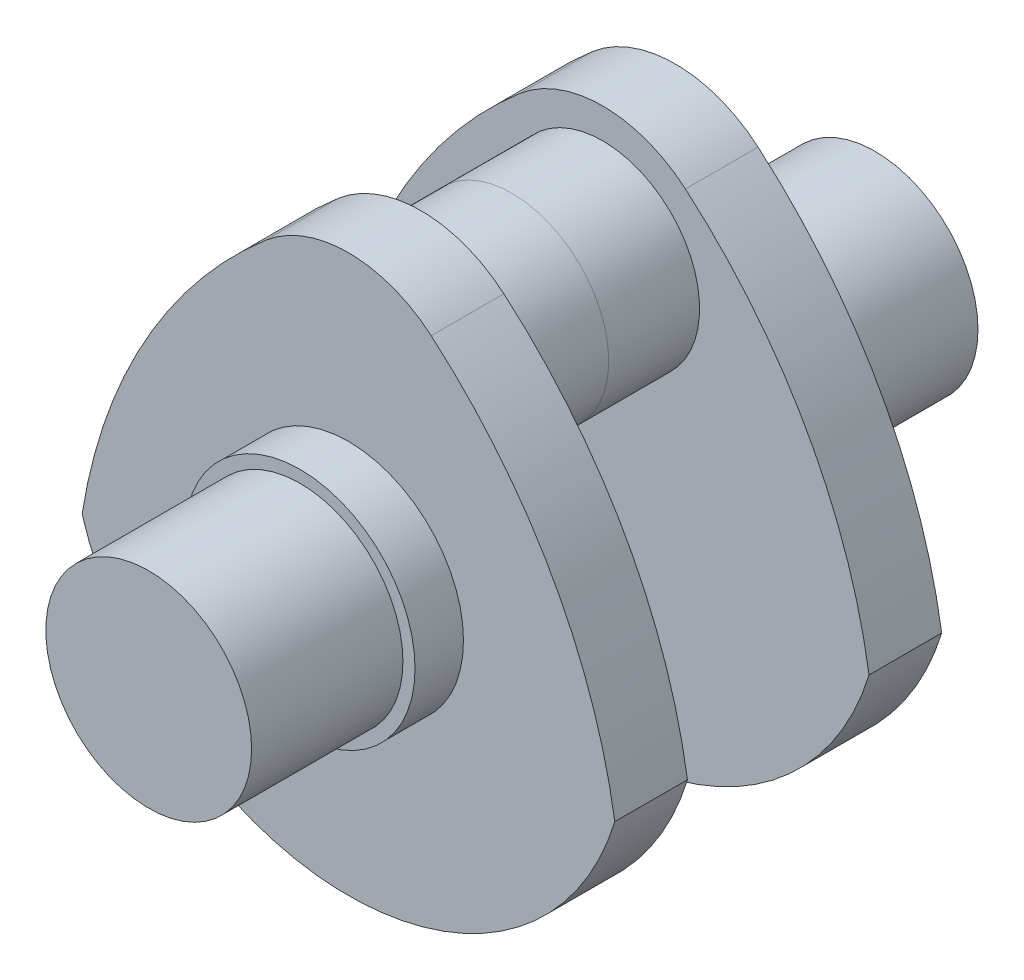
from build123d import *

# Parameters (mm, degrees)
SKETCH1_R           = 17
BOSS_EXTRUDE1_DEPTH = 33
SKETCH2_R           = 19
BOSS_EXTRUDE2_DEPTH = 8
BOSS_EXTRUDE3_DEPTH = 12
SKETCH4_R           = 16
BOSS_EXTRUDE4_DEPTH = 15


with BuildPart() as part:
    # Sketch1 → Boss-Extrude1 (new body)
    with BuildSketch(Plane.XY):
        Circle(SKETCH1_R)
    extrude(amount=BOSS_EXTRUDE1_DEPTH)

    # Sketch2 → Boss-Extrude2 (add)
    with BuildSketch(Plane.XY):
        Circle(SKETCH2_R)
    extrude(amount=BOSS_EXTRUDE2_DEPTH)

    # Sketch3 → Boss-Extrude3 (add)
    with BuildSketch(Plane(origin=(0, 0, 0), x_dir=(-1, 0, 0), z_dir=(0, 0, -1))):
        with BuildLine():
            ThreePointArc((-44, -13.416407865), (0, -46), (44, -13.416407865))
            ThreePointArc((44, -13.416407865), (33.683444249, 16.469257624), (13.668094758, 40.943123461))
            ThreePointArc((13.668094758, 40.943123461), (0, 46), (-13.668094758, 40.943123461))
            ThreePointArc((-13.668094758, 40.943123461), (-33.683444249, 16.469257624), (-44, -13.416407865))
        make_face()
    extrude(amount=BOSS_EXTRUDE3_DEPTH)

    # Sketch4 → Boss-Extrude4 (add)
    with BuildSketch(Plane(origin=(0, 0, -12), x_dir=(-1, 0, 0), z_dir=(0, 0, -1))):
        with Locations((0, 25)):
            Circle(SKETCH4_R)
    extrude(amount=BOSS_EXTRUDE4_DEPTH)


with BuildPart() as body_2:
    # Mirror1: mirrored copy
    add(part.part.mirror(Plane(origin=(0, 25, -27), x_dir=(1, 0, 0), z_dir=(0, 0, -1))))


solid = Compound([part.part, body_2.part])
